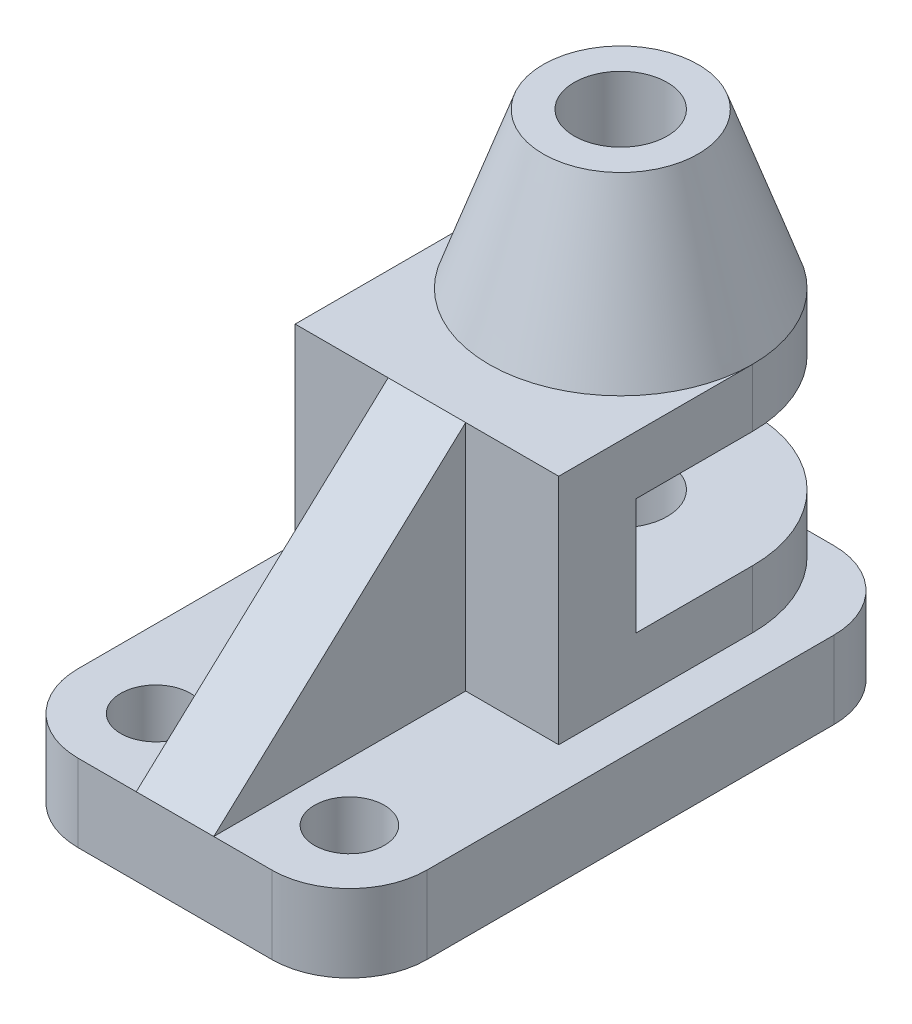
from build123d import *

# Parameters (mm, degrees)
SKETCH1_W           = 90
SKETCH1_H           = 145
BOSS_EXTRUDE2_DEPTH = 10
FILLET2_R           = 20
BOSS_EXTRUDE6_DEPTH = 60
CUT_EXTRUDE1_START  = -45
CUT_EXTRUDE1_DEPTH  = 30
SKETCH13_R          = 12
CUT_EXTRUDE2_DEPTH  = 127
BOSS_EXTRUDE8_DEPTH = 10
SKETCH17_R          = 9
CUT_EXTRUDE3_DEPTH  = 20


with BuildPart() as part:
    # Sketch1 → Boss-Extrude2 (new, symmetric)
    with BuildSketch(Plane(origin=(0, 0, 0), x_dir=(1, 0, 0), z_dir=(0, 1, 0))):
        Rectangle(SKETCH1_W, SKETCH1_H)
    extrude(amount=BOSS_EXTRUDE2_DEPTH, both=True)

    # Fillet2
    fillet2_edges = [part.edges().sort_by_distance(p)[0] for p in [
        (45, 0, -72.5),
        (45, 0, 72.5),
        (-45, 0, 72.5),
        (-45, 0, -72.5),
    ]]
    fillet(fillet2_edges, radius=FILLET2_R)

    # Sketch8 → Boss-Extrude6 (add)
    with BuildSketch(Plane(origin=(0, 10, 0), x_dir=(1, 0, 0), z_dir=(0, 1, 0))):
        with BuildLine():
            Line((-34, -7.5), (-34, 42.5))
            ThreePointArc((-34, 42.5), (0, 76.5), (34, 42.5))
            Line((34, 42.5), (34, -7.5))
            Line((34, -7.5), (-34, -7.5))
        make_face()
    extrude(amount=BOSS_EXTRUDE6_DEPTH)

    # Sketch9 → Cut-Extrude1 (cut)
    with BuildSketch(Plane(origin=(0, 70, 0), x_dir=(1, 0, 0), z_dir=(0, 1, 0)).offset(CUT_EXTRUDE1_START)):
        with BuildLine():
            Line((-34, 42.5), (-34, 12.5))
            Line((-34, 12.5), (34, 12.5))
            Line((34, 12.5), (34, 42.5))
            ThreePointArc((34, 42.5), (0, 76.5), (-34, 42.5))
        make_face()
    extrude(amount=CUT_EXTRUDE1_DEPTH, mode=Mode.SUBTRACT)

    # Sketch12 → Revolve1 (revolve)
    with BuildSketch(Plane.XY.offset(-42.5), mode=Mode.PRIVATE) as revolve1_sk:
        Polygon((0, 70), (0, 110), (20, 110), (34, 70), align=None)
    revolve(revolve1_sk.sketch.rotate(Axis((0, 70, -42.5), (0, 1, 0)), 180), axis=Axis((0, 70, -42.5), (0, 1, 0)))

    # Sketch13 → Cut-Extrude2 (cut)
    with BuildSketch(Plane(origin=(0, 110, 0), x_dir=(1, 0, 0), z_dir=(0, 1, 0))):
        with Locations(Location((0, 42.5, 0), (0, 0, 270))):
            Circle(SKETCH13_R)
    extrude(amount=-CUT_EXTRUDE2_DEPTH, mode=Mode.SUBTRACT)

    # Sketch16 → Boss-Extrude8 (add, symmetric)
    with BuildSketch(Plane(origin=(0, 0, 0), x_dir=(0, 0, -1), z_dir=(1, 0, 0))):
        Polygon((-7.5, 70), (-72.5, 10), (-7.5, 10), align=None)
    extrude(amount=BOSS_EXTRUDE8_DEPTH, both=True)

    # Sketch17 → Cut-Extrude3 (cut)
    with BuildSketch(Plane(origin=(0, 10, 0), x_dir=(1, 0, 0), z_dir=(0, 1, 0))):
        with Locations(Location((25, -52.5, 0), (0, 0, 270))):
            Circle(SKETCH17_R)
    cut_extrude3 = extrude(amount=-CUT_EXTRUDE3_DEPTH, mode=Mode.SUBTRACT)

    # Mirror1: Cut-Extrude3 across plane
    add(cut_extrude3.mirror(Plane(origin=(0, 0, 0), x_dir=(0, 0, 1), z_dir=(1, 0, 0))), mode=Mode.SUBTRACT)


solid = part.part
